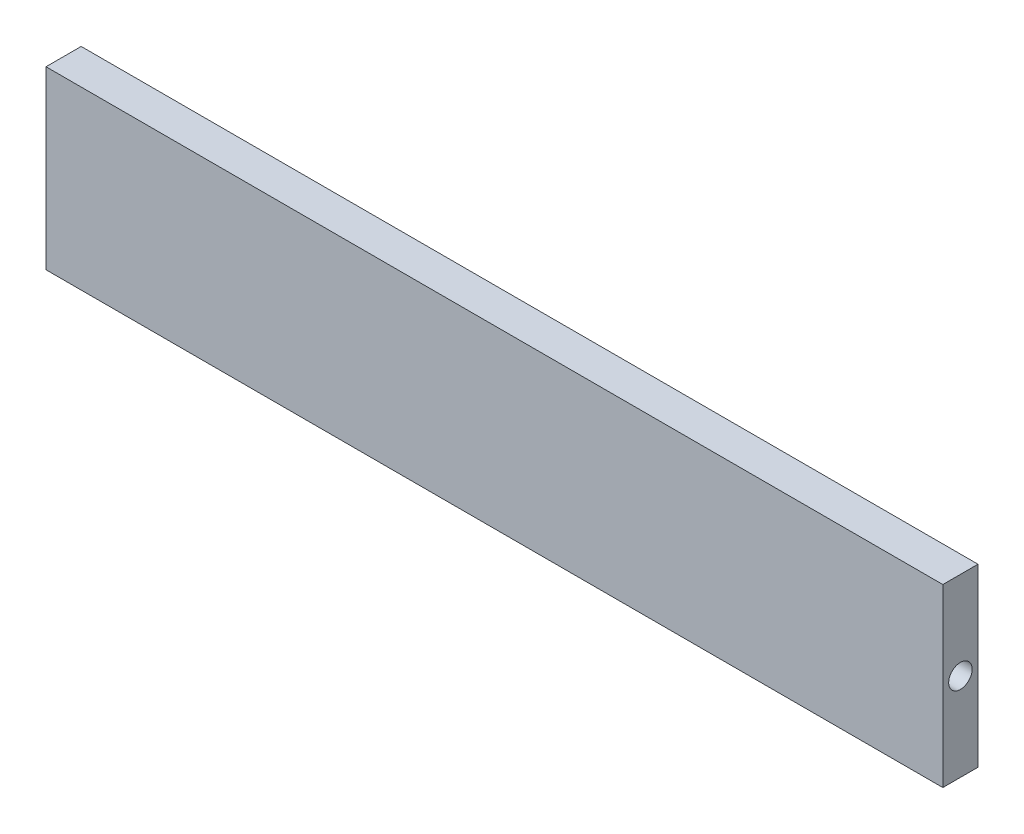
from build123d import *

# Parameters (mm, degrees)
SKETCH1_W           = 76.5
SKETCH1_H           = 15
BOSS_EXTRUDE1_DEPTH = 3
SKETCH2_R           = 1
CUT_EXTRUDE1_DEPTH  = 77.92528843


with BuildPart() as part:
    # Sketch1 → Boss-Extrude1 (new body)
    with BuildSketch(Plane.XY):
        Rectangle(SKETCH1_W, SKETCH1_H)
    extrude(amount=BOSS_EXTRUDE1_DEPTH)

    # Sketch2 → Cut-Extrude1 (cut, through all)
    with BuildSketch(Plane(origin=(38.25, 0, 0), x_dir=(0, 0, -1), z_dir=(1, 0, 0))):
        with Locations((-1.5, 0)):
            Circle(SKETCH2_R)
    extrude(amount=-CUT_EXTRUDE1_DEPTH, mode=Mode.SUBTRACT)


solid = part.part
